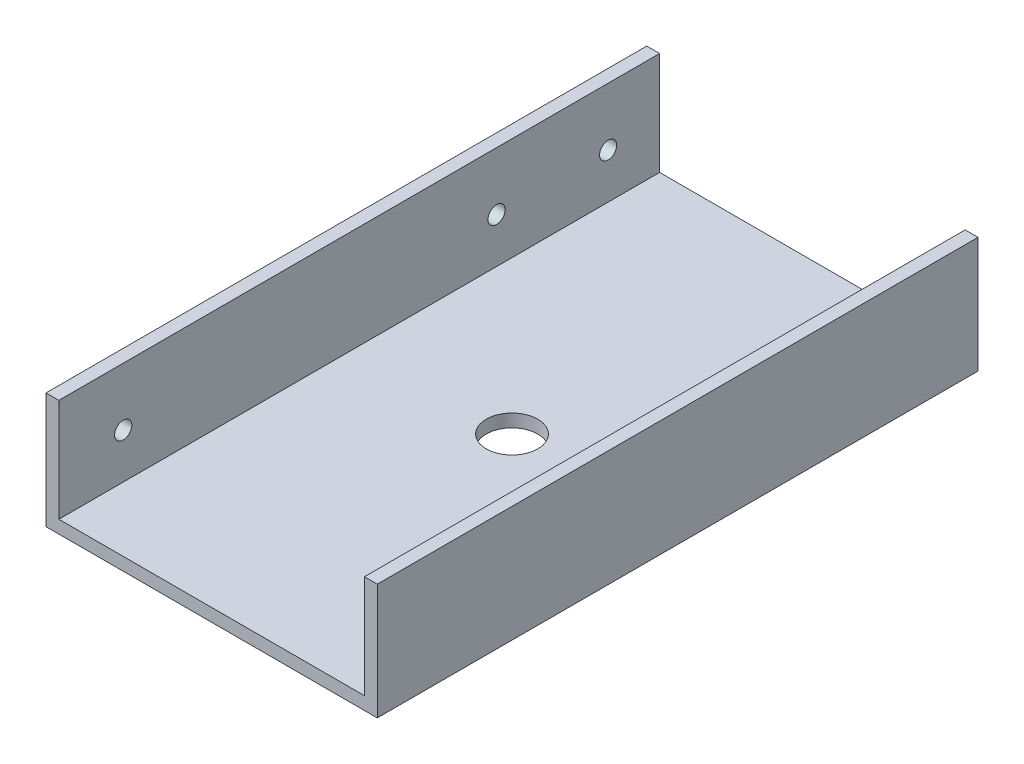
from build123d import *

# Parameters (mm, degrees)
BOSS_EXTRUDE1_DEPTH = 35
SKETCH2_R           = 3
CUT_EXTRUDE1_DEPTH  = 43.186964811
CUT_EXTRUDE3_REACH  = 55.826
SKETCH4_R           = 1


with BuildPart() as part:
    # Sketch1 → Boss-Extrude1 (new, symmetric)
    with BuildSketch(Plane.XY):
        Polygon((-19.3, 13.5), (-19.3, 0), (19.3, 0), (19.3, 13.5), (17.8, 13.5), (17.8, 1.5), (-17.8, 1.5), (-17.8, 13.5), align=None)
    extrude(amount=BOSS_EXTRUDE1_DEPTH, both=True)

    # Sketch2 → Cut-Extrude1 (cut, through all)
    with BuildSketch(Plane.XZ):
        with Locations(Location((0, 0, 0), (0, 0, 270))):
            Circle(SKETCH2_R)
    extrude(amount=-CUT_EXTRUDE1_DEPTH, mode=Mode.SUBTRACT)

    # Sketch4 → Cut-Extrude3 (cut, up to next)
    with BuildSketch(Plane.ZY.offset(19.3), mode=Mode.PRIVATE) as cut_extrude3_sk1:
        with Locations(Location((-29, 6.75, 0), (0, 0, 270))):
            Circle(SKETCH4_R)
    cut_extrude3_tool1 = extrude(cut_extrude3_sk1.sketch, amount=-CUT_EXTRUDE3_REACH, mode=Mode.PRIVATE) & part.part
    # Sketch4 → Cut-Extrude3 (cut, up to next)
    with BuildSketch(Plane.ZY.offset(19.3), mode=Mode.PRIVATE) as cut_extrude3_sk2:
        with Locations(Location((-16, 6.75, 0), (0, 0, 270))):
            Circle(SKETCH4_R)
    cut_extrude3_tool2 = extrude(cut_extrude3_sk2.sketch, amount=-CUT_EXTRUDE3_REACH, mode=Mode.PRIVATE) & part.part
    # Sketch4 → Cut-Extrude3 (cut, up to next)
    with BuildSketch(Plane.ZY.offset(19.3), mode=Mode.PRIVATE) as cut_extrude3_sk3:
        with Locations(Location((27.5, 6.75, 0), (0, 0, 270))):
            Circle(SKETCH4_R)
    cut_extrude3_tool3 = extrude(cut_extrude3_sk3.sketch, amount=-CUT_EXTRUDE3_REACH, mode=Mode.PRIVATE) & part.part
    add(cut_extrude3_tool1.solids().sort_by_distance((-19.3, 6.75, -29))[0], mode=Mode.SUBTRACT)
    add(cut_extrude3_tool2.solids().sort_by_distance((-19.3, 6.75, -16))[0], mode=Mode.SUBTRACT)
    add(cut_extrude3_tool3.solids().sort_by_distance((-19.3, 6.75, 27.5))[0], mode=Mode.SUBTRACT)


solid = part.part
